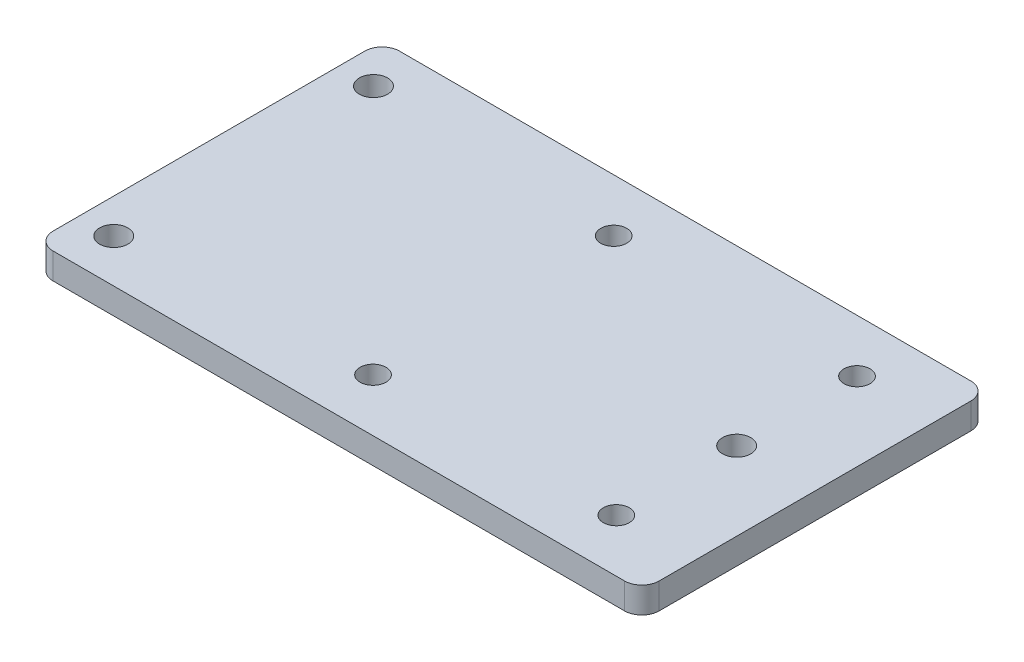
from build123d import *

# Parameters (mm, degrees)
SKETCH1_W             = 70
SKETCH1_H             = 40
BOSS_EXTRUDE1_DEPTH   = 3
F_3_0MM_DOWEL_HOLE1_D = 3
F_4_CLEARANCE_HOLE1_D = 3.2639
FILLET1_R             = 2


with BuildPart() as part:
    # Sketch1 → Boss-Extrude1 (new body)
    with BuildSketch(Plane(origin=(0, 0, 0), x_dir=(1, 0, 0), z_dir=(0, 1, 0))):
        Rectangle(SKETCH1_W, SKETCH1_H)
    extrude(amount=BOSS_EXTRUDE1_DEPTH)

    # Ø3.0mm Dowel Hole1 (through all)
    with Locations(Plane(origin=(0, 3, 0), x_dir=(1, 0, 0), z_dir=(0, 1, 0))):
        with Locations((-2.15, 13.9), (25.95, 13.9), (-2.15, -13.9), (25.95, -13.9)):
            Hole(F_3_0MM_DOWEL_HOLE1_D / 2)

    # #4 Clearance Hole1 (through all)
    with Locations(Plane(origin=(0, 3, 0), x_dir=(1, 0, 0), z_dir=(0, 1, 0))):
        with Locations((-31, 15), (-31, -15), (25.95, 0)):
            Hole(F_4_CLEARANCE_HOLE1_D / 2)

    # Fillet1
    fillet1_edges = [part.edges().sort_by_distance(p)[0] for p in [
        (35, 1.5, 20),
        (-35, 1.5, 20),
        (-35, 1.5, -20),
        (35, 1.5, -20),
    ]]
    fillet(fillet1_edges, radius=FILLET1_R)


solid = part.part
